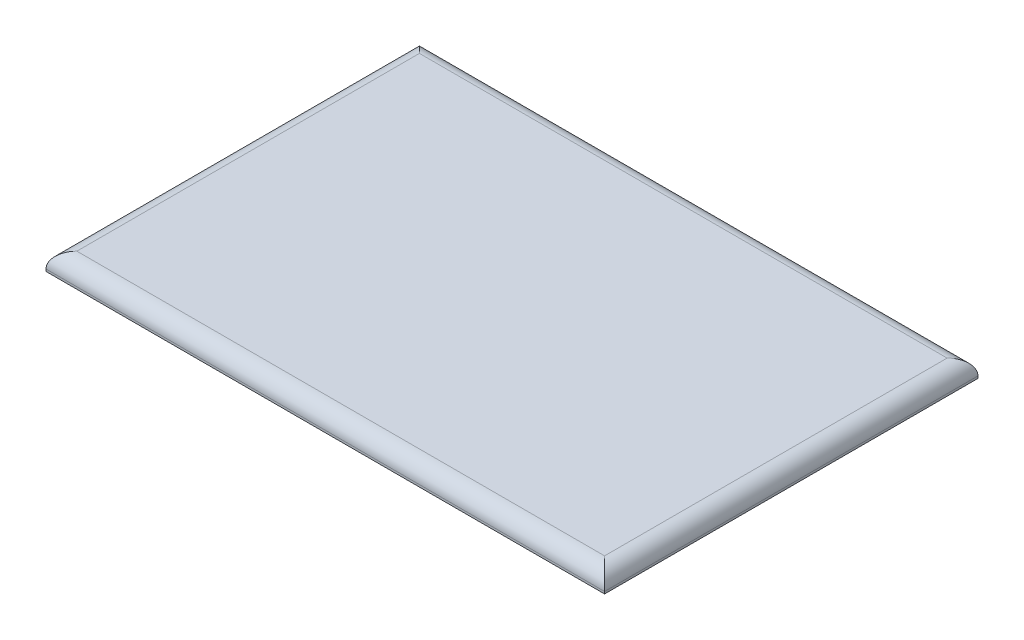
from build123d import *

# Parameters (mm, degrees)
SKETCH1_W           = 91.948
SKETCH1_H           = 61.468
BOSS_EXTRUDE1_DEPTH = 2.8956
SKETCH2_W           = 33.1216
SKETCH2_H           = 33.1216
BOSS_EXTRUDE2_DEPTH = 5.3848
FILLET1_R           = 2.54


with BuildPart() as part:
    # Sketch1 → Boss-Extrude1 (new body)
    with BuildSketch(Plane(origin=(0, 0, 0), x_dir=(1, 0, 0), z_dir=(0, 1, 0))):
        with Locations((45.974, 30.734)):
            Rectangle(SKETCH1_W, SKETCH1_H)
    extrude(amount=BOSS_EXTRUDE1_DEPTH)

    # Sketch2 → Boss-Extrude2 (add)
    with BuildSketch(Plane.XZ):
        with Locations((16.5608, -30.734)):
            Rectangle(SKETCH2_W, SKETCH2_H)
    extrude(amount=BOSS_EXTRUDE2_DEPTH)

    # Fillet1
    fillet1_edges = [part.edges().sort_by_distance(p)[0] for p in [
        (91.948, 2.8956, -30.734),
        (45.974, 2.8956, -61.468),
        (0, 2.8956, -30.734),
        (45.974, 2.8956, 0),
    ]]
    fillet(fillet1_edges, radius=FILLET1_R)


solid = part.part
